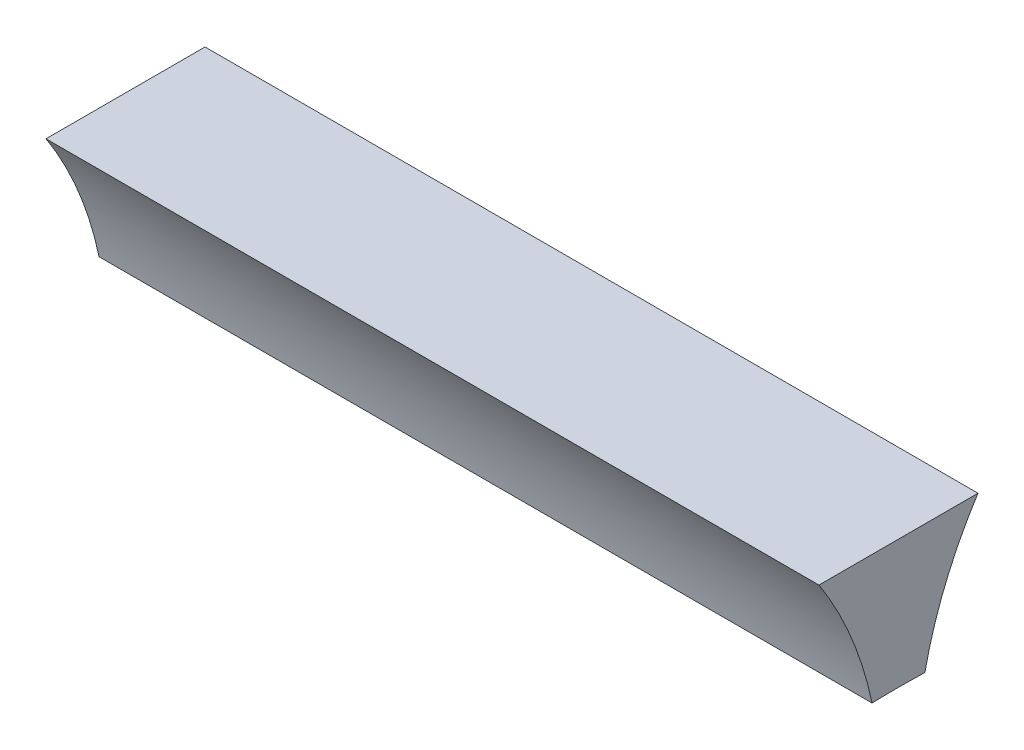
from build123d import *

# Parameters (mm, degrees)
BASPROSKE_W     = 20
BASPROSKE_H     = 26.25
TOOTHCUT_DEPTH  = 43.167819484
TEETHCUTS_COUNT = 33
TEETHCUTS_ANGLE = 349.090909091
BORSKE_R        = 15
BORE_DEPTH      = 50.0000508
KEYSKE_W        = 10
KEYSKE_H        = 18.3
KEYWAY_DEPTH    = 50.0000508
EXTRUDE_START   = 1
SKETCH_1_R      = 28
EXTRUDE_2_DEPTH = 1
SKETCH_2_R      = 28
EXTRUDE_3_DEPTH = 1
EXTRUDE_4_DEPTH = 10


with BuildPart() as part:
    # BasProSke → Base-Revolve (revolve)
    with BuildSketch(Plane(origin=(0, 0, 0), x_dir=(1, 0, 0), z_dir=(0, 1, 0)), mode=Mode.PRIVATE) as base_revolve_sk:
        with Locations((10, 13.125)):
            Rectangle(BASPROSKE_W, BASPROSKE_H)
    revolve(base_revolve_sk.sketch.rotate(Axis((-10, 0, 0), (1, 0, 0)), 180), axis=Axis((-10, 0, 0), (1, 0, 0)))

    # TooCutSke → ToothCut (cut, through all)
    with BuildSketch(Plane(origin=(0, 0, 0), x_dir=(0, 0, -1), z_dir=(1, 0, 0))):
        with BuildLine():
            ThreePointArc((0.683690741, 22.863780155), (0, 22.874), (-0.683690741, 22.863780155))
            ThreePointArc((-0.683690741, 22.863780155), (-1.217783987, 24.592276227), (-2.057504394, 26.194719331))
            ThreePointArc((-2.057504394, 26.194719331), (0, 26.2754), (2.057504394, 26.194719331))
            ThreePointArc((2.057504394, 26.194719331), (1.217783987, 24.592276227), (0.683690741, 22.863780155))
        make_face()
    toothcut = extrude(amount=TOOTHCUT_DEPTH, mode=Mode.SUBTRACT)

    # TeethCuts: ToothCut ×33 about axis
    teethcuts_axis = Axis((-10, 0, 0), (1, 0, 0))
    for i in range(1, TEETHCUTS_COUNT):
        add(toothcut.rotate(teethcuts_axis, i * TEETHCUTS_ANGLE / (TEETHCUTS_COUNT - 1)), mode=Mode.SUBTRACT)

    # BorSke → Bore (cut, symmetric)
    with BuildSketch(Plane(origin=(0, 0, 0), x_dir=(0, 0, -1), z_dir=(1, 0, 0))):
        with Locations(Location((0, 0, 0), (0, 0, 180))):
            Circle(BORSKE_R)
    extrude(amount=BORE_DEPTH, both=True, mode=Mode.SUBTRACT)

    # KeySke → Keyway (cut, symmetric)
    with BuildSketch(Plane(origin=(0, 0, 0), x_dir=(0, 0, -1), z_dir=(1, 0, 0))):
        with Locations((0, 9.15)):
            Rectangle(KEYSKE_W, KEYSKE_H)
    extrude(amount=KEYWAY_DEPTH, both=True, mode=Mode.SUBTRACT)

    # Эскиз1 → Бобышка-Вытянуть2 (add)
    with BuildSketch(Plane(origin=(20, 0, 0), x_dir=(0, 0, -1), z_dir=(1, 0, 0)).offset(EXTRUDE_START)):
        Circle(SKETCH_1_R)
        with BuildLine():
            Line((5, 18.3), (-5, 18.3))
            Line((-5, 18.3), (-5, 14.142135624))
            ThreePointArc((-5, 14.142135624), (0, -15), (5, 14.142135624))
            Line((5, 14.142135624), (5, 18.3))
        make_face(mode=Mode.SUBTRACT)
    extrude(amount=-EXTRUDE_2_DEPTH)

    # Эскиз2 → Бобышка-Вытянуть3 (add)
    with BuildSketch(Plane.ZY):
        with Locations(Location((0, 0, 0), (0, 0, 180))):
            Circle(SKETCH_2_R)
        with BuildLine():
            Line((-5, 18.3), (-5, 14.142135624))
            ThreePointArc((-5, 14.142135624), (0, -15), (5, 14.142135624))
            Line((5, 14.142135624), (5, 18.3))
            Line((5, 18.3), (-5, 18.3))
        make_face(mode=Mode.SUBTRACT)
    extrude(amount=EXTRUDE_3_DEPTH)


with BuildPart() as body_2:
    # Эскиз4 → Бобышка-Вытянуть4 (new, symmetric)
    with BuildSketch(Plane(origin=(10, 0, 0), x_dir=(0, 0, -1), z_dir=(1, 0, 0))):
        with BuildLine():
            Line((-2.057504394, 26.194719331), (2.057504394, 26.194719331))
            ThreePointArc((2.057504394, 26.194719331), (1.217783987, 24.592276227), (0.683690741, 22.863780155))
            ThreePointArc((0.683690741, 22.863780155), (0, 22.874), (-0.683690741, 22.863780155))
            ThreePointArc((-0.683690741, 22.863780155), (-1.217783987, 24.592276227), (-2.057504394, 26.194719331))
        make_face()
    extrude(amount=EXTRUDE_4_DEPTH, both=True)


solid = body_2.part
